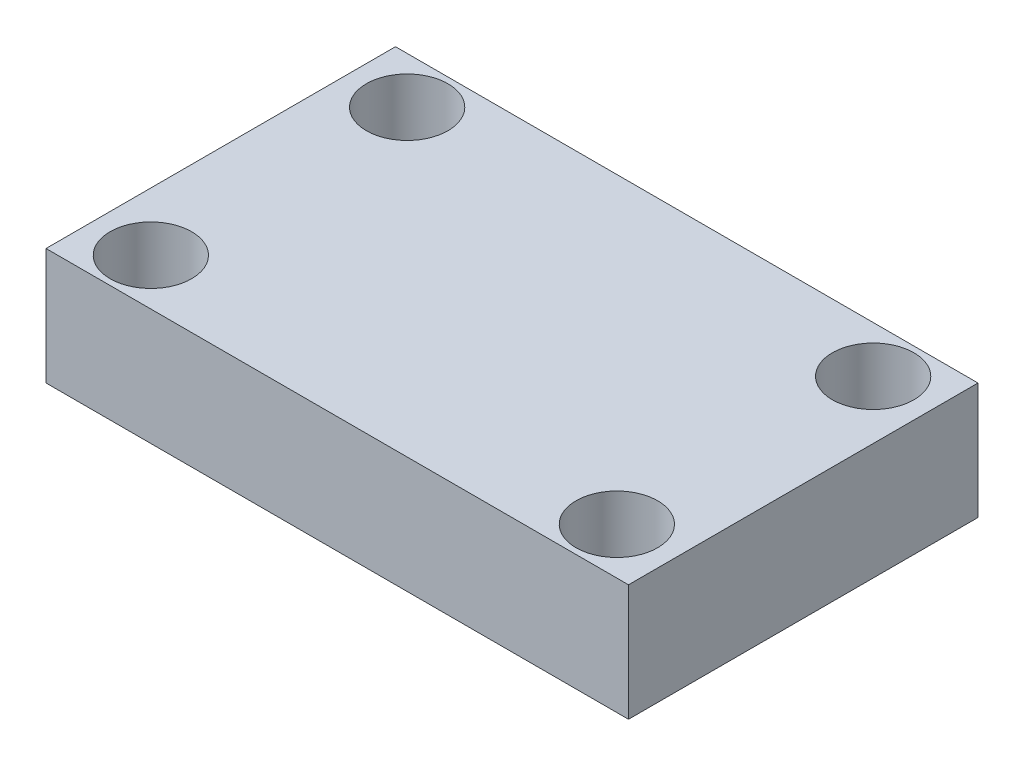
from build123d import *

# Parameters (mm, degrees)
SKETCH1_W           = 500
SKETCH1_H           = 300
BOSS_EXTRUDE1_DEPTH = 100
SKETCH2_R           = 35
CUT_EXTRUDE2_DEPTH  = 309.220700148


with BuildPart() as part:
    # Sketch1 → Boss-Extrude1 (new body)
    with BuildSketch(Plane(origin=(0, 0, 0), x_dir=(1, 0, 0), z_dir=(0, 1, 0))):
        Rectangle(SKETCH1_W, SKETCH1_H)
    extrude(amount=BOSS_EXTRUDE1_DEPTH)

    # Sketch2 → Cut-Extrude2 (cut, through all)
    with BuildSketch(Plane(origin=(0, 0, 0), x_dir=(1, 0, 0), z_dir=(0, 1, 0))):
        with Locations(Location((-200, 110, 0), (0, 0, 270))):
            Circle(SKETCH2_R)
        with Locations(Location((200, 110, 0), (0, 0, 270))):
            Circle(SKETCH2_R)
        with Locations(Location((200, -110, 0), (0, 0, 270))):
            Circle(SKETCH2_R)
        with Locations(Location((-200, -110, 0), (0, 0, 270))):
            Circle(SKETCH2_R)
    extrude(amount=CUT_EXTRUDE2_DEPTH, mode=Mode.SUBTRACT)


solid = part.part
